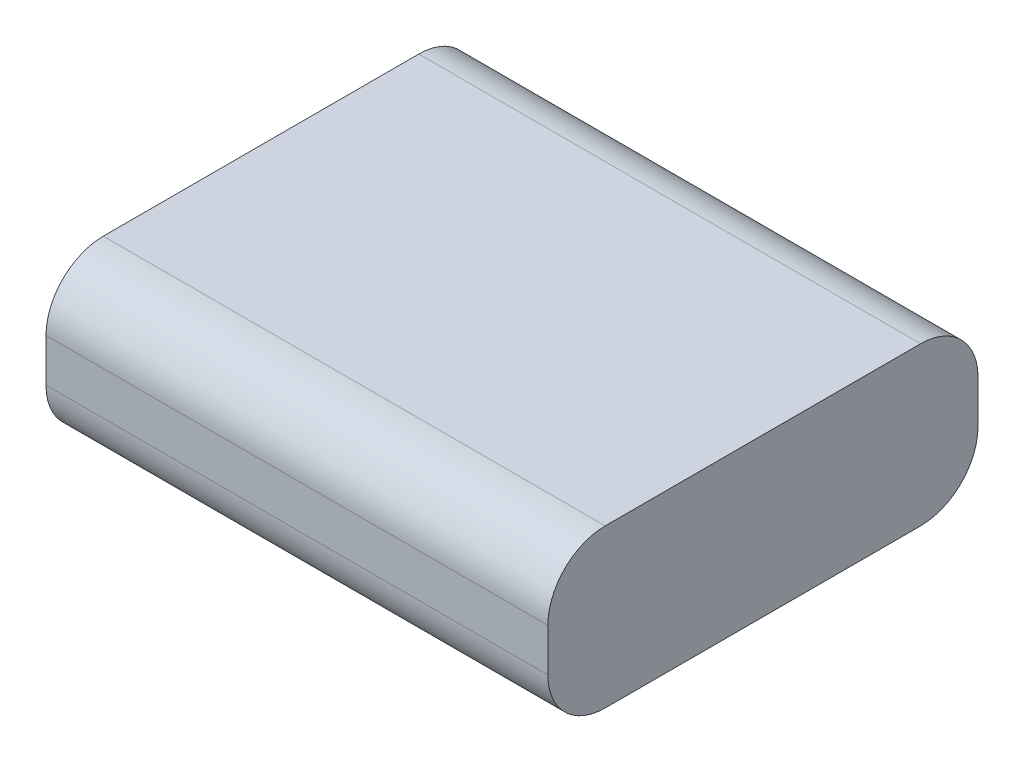
from build123d import *

# Parameters (mm, degrees)
SKETCH_1_W      = 70
SKETCH_1_H      = 60
EXTRUDE_1_DEPTH = 22
FILLET_1_R      = 8


with BuildPart() as part:
    # 草图1 → 凸台-拉伸1 (new body)
    with BuildSketch(Plane(origin=(0, 0, 0), x_dir=(1, 0, 0), z_dir=(0, 1, 0))):
        Rectangle(SKETCH_1_W, SKETCH_1_H)
    extrude(amount=EXTRUDE_1_DEPTH)

    # 圆角1
    fillet_1_edges = [part.edges().sort_by_distance(p)[0] for p in [
        (0, 22, 30),
        (0, 0, 30),
        (0, 0, -30),
        (0, 22, -30),
    ]]
    fillet(fillet_1_edges, radius=FILLET_1_R)


solid = part.part
